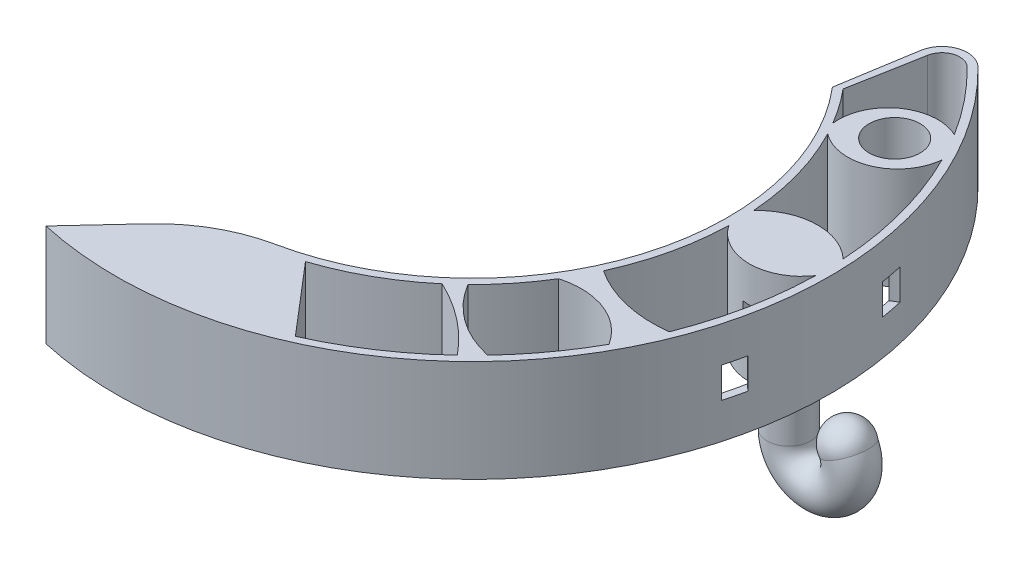
from build123d import *

# Parameters (mm, degrees)
BOSS_EXTRUDE1_DEPTH        = 13.33
FILLET1_R                  = 20
SKETCH3_R                  = 3.33
CUT_EXTRUDE2_DEPTH         = 68.320131462
FILLET2_R                  = 3.333
SKETCH4_R                  = 2.8333333
DOME1_FACE_RADIUS          = 2.8333333
DOME1_HEIGHT               = 3.3333333
CUT_EXTRUDE3_DEPTH         = 2
MIRROR3_COPY_1_FACE_RADIUS = 2.8333333
MIRROR3_COPY_1_HEIGHT      = 3.3333333
SKETCH16_W                 = 36.728720905
SKETCH16_H                 = 19.011400322
CUT_EXTRUDE4_DEPTH         = 30
CUT_EXTRUDE5_DEPTH         = 71.999747127
SKETCH19_R                 = 1.425
CUT_EXTRUDE6_DEPTH         = 8.6


with BuildPart() as part:
    # Sketch1 → Boss-Extrude1 (new body)
    with BuildSketch(Plane(origin=(0, 0, 0), x_dir=(1, 0, 0), z_dir=(0, 1, 0))):
        with BuildLine():
            Line((25.438564969, 21.535280641), (27.993333135, 37.33))
            ThreePointArc((27.993333135, 37.33), (42.371570445, -19.53984693), (-10.216878485, -45.527694802))
            Line((-10.216878485, -45.527694802), (1.110949751, -33.311479863))
            ThreePointArc((1.110949751, -33.311479863), (30.46737546, -13.513990254), (25.438564969, 21.535280641))
        make_face()
    extrude(amount=BOSS_EXTRUDE1_DEPTH)

    # Fillet1
    fillet1_edges = [part.edges().sort_by_distance(p)[0] for p in [
        (1.110949751, 6.665, 33.311479863),
    ]]
    fillet(fillet1_edges, radius=FILLET1_R)

    # Sketch3 → Cut-Extrude2 (cut, through all)
    with BuildSketch(Plane(origin=(0, 13.33, 0), x_dir=(1, 0, 0), z_dir=(0, 1, 0))):
        with Locations(Location((35.289122258, 19.812921474, 0), (0, 0, 270))):
            Circle(SKETCH3_R)
    extrude(amount=-CUT_EXTRUDE2_DEPTH, mode=Mode.SUBTRACT)

    # Fillet2
    fillet2_edges = [part.edges().sort_by_distance(p)[0] for p in [
        (27.993333135, 6.665, -37.33),
    ]]
    fillet(fillet2_edges, radius=FILLET2_R)

    # Sweep1: sweep along a path in Sketch6
    with BuildLine(Plane.XY) as sweep1_path:
        Line((40.567020893, 13.33), (40.567020893, 20.636666))
        ThreePointArc((40.567020893, 20.636666), (45.529478945, 24.636666), (48.384610469, 18.938050913))
    # Sketch4 → Sweep1 (sweep)
    with BuildSketch(Plane(origin=(0, 13.33, 0), x_dir=(1, 0, 0), z_dir=(0, 1, 0))):
        with Locations((40.567020893, 0.715488074)):
            Circle(SKETCH4_R)
    sweep1 = sweep(path=sweep1_path.line)

    # Dome1: a dome of height H over a round flat face of radius A is a cap of a sphere of radius (A * A + H * H) / (2 * H)
    dome1_r = (DOME1_FACE_RADIUS * DOME1_FACE_RADIUS + DOME1_HEIGHT * DOME1_HEIGHT) / (2 * DOME1_HEIGHT)
    dome1_base = Plane((48.384610469, 18.938050913, -0.715488074), z_dir=(-0.414971112372, -0.909834587107, 0))
    with Locations(dome1_base.offset(DOME1_HEIGHT - dome1_r)):
        dome1_ball = Sphere(dome1_r, mode=Mode.PRIVATE)
    add(split(dome1_ball, bisect_by=dome1_base, keep=Keep.TOP, mode=Mode.PRIVATE))

    # Sketch7 → Cut-Extrude3 (cut, symmetric)
    with BuildSketch(Plane(origin=(0, 6.665, 0), x_dir=(1, 0, 0), z_dir=(0, 1, 0))):
        with BuildLine():
            ThreePointArc((44.965852541, -12.459041105), (45.327303444, -11.072089345), (45.645985213, -9.674690379))
            ThreePointArc((45.645985213, -9.674690379), (41.52914689, -0.997602982), (46.057874066, 7.47180276))
            ThreePointArc((46.057874066, 7.47180276), (45.806657105, 8.882891694), (45.51221871, 10.285599066))
            ThreePointArc((45.51221871, 10.285599066), (38.862616133, -0.933548234), (44.965852541, -12.459041105))
        make_face()
    extrude(amount=CUT_EXTRUDE3_DEPTH, both=True, mode=Mode.SUBTRACT)

    # Mirror3: Sweep1 across plane
    add(sweep1.mirror(Plane.ZX.offset(6.665)))

    # Mirror3 copy 1: a dome of height H over a round flat face of radius A is a cap of a sphere of radius (A * A + H * H) / (2 * H)
    mirror3_copy_1_r = (MIRROR3_COPY_1_FACE_RADIUS * MIRROR3_COPY_1_FACE_RADIUS + MIRROR3_COPY_1_HEIGHT * MIRROR3_COPY_1_HEIGHT) / (2 * MIRROR3_COPY_1_HEIGHT)
    mirror3_copy_1_base = Plane((48.384610469, -5.608050913, -0.715488074), z_dir=(-0.414971112372, 0.909834587107, 0))
    with Locations(mirror3_copy_1_base.offset(MIRROR3_COPY_1_HEIGHT - mirror3_copy_1_r)):
        mirror3_copy_1_ball = Sphere(mirror3_copy_1_r, mode=Mode.PRIVATE)
    add(split(mirror3_copy_1_ball, bisect_by=mirror3_copy_1_base, keep=Keep.TOP, mode=Mode.PRIVATE))

    # Sketch16 → Cut-Extrude4 (cut)
    with BuildSketch(Plane(origin=(0, 13.33, 0), x_dir=(1, 0, 0), z_dir=(0, 1, 0))):
        with Locations((41.954103887, 0)):
            Rectangle(SKETCH16_W, SKETCH16_H)
    extrude(amount=CUT_EXTRUDE4_DEPTH, mode=Mode.SUBTRACT)

    # Sketch18 → Cut-Extrude5 (cut, through all)
    with BuildSketch(Plane.XZ):
        with BuildLine():
            Line((28.039143401, -31.35294351), (26.341104847, -22.015791956))
            ThreePointArc((26.341104847, -22.015791956), (28.034108775, -19.815086303), (29.543730196, -17.484762112))
            ThreePointArc((29.543730196, -17.484762112), (32.195597251, -23.521489799), (38.760601016, -24.1340301))
            ThreePointArc((38.760601016, -24.1340301), (35.637384762, -28.544919116), (32.014856699, -32.555868143))
            ThreePointArc((32.014856699, -32.555868143), (29.659442281, -33.169198731), (28.039143401, -31.35294351))
        make_face()
        with BuildLine():
            Line((18.550254331, 41.721980589), (10.749078367, 32.603776074))
            ThreePointArc((10.749078367, 32.603776074), (16.777611199, 29.950970977), (22.188585816, 26.195716434))
            ThreePointArc((22.188585816, 26.195716434), (27.124492616, 29.226219474), (31.260994101, 33.280412374))
            ThreePointArc((31.260994101, 33.280412374), (25.260742984, 38.035910189), (18.550254331, 41.721980589))
        make_face()
        with BuildLine():
            ThreePointArc((40.820629514, -20.457561098), (36.928571374, -15.146521153), (30.394540812, -15.959974588))
            ThreePointArc((30.394540812, -15.959974588), (33.016991898, -9.403570916), (34.242514373, -2.449307946))
            ThreePointArc((34.242514373, -2.449307946), (39.834796056, -4.973265496), (45.573843855, -2.803632696))
            ThreePointArc((45.573843855, -2.803632696), (44.089869065, -11.870932812), (40.820629514, -20.457561098))
        make_face()
        with BuildLine():
            ThreePointArc((45.651589838, 0.876324867), (39.98520163, 3.873028579), (34.318813422, 0.876324867))
            ThreePointArc((34.318813422, 0.876324867), (33.458600037, 7.685764997), (31.260994101, 14.187993085))
            ThreePointArc((31.260994101, 14.187993085), (36.627069292, 16.498940097), (42.462553984, 16.785919968))
            ThreePointArc((42.462553984, 16.785919968), (44.769458221, 8.973918351), (45.651589838, 0.876324867))
        make_face()
        with BuildLine():
            ThreePointArc((39.931059829, 22.143758962), (35.264351947, 18.298272838), (29.224062449, 18.013968857))
            ThreePointArc((29.224062449, 18.013968857), (26.794540492, 21.461628545), (23.960583625, 24.58534792))
            ThreePointArc((23.960583625, 24.58534792), (27.897400776, 28.917406773), (33.24466644, 31.299005627))
            ThreePointArc((33.24466644, 31.299005627), (36.873111669, 26.929709168), (39.931059829, 22.143758962))
        make_face()
    extrude(amount=-CUT_EXTRUDE5_DEPTH, mode=Mode.SUBTRACT)

    # Sketch19 → Cut-Extrude6 (cut, symmetric)
    with BuildSketch(Plane(origin=(15.613362891, 0, 27.64706404), x_dir=(0.8707413871359999, 0, -0.491741229437267), z_dir=(0.491741229437267, 0, 0.8707413871359999))):
        with Locations(Location((-14.136648815, 6.665, 0), (0, 0, 180))):
            Circle(SKETCH19_R)
    extrude(amount=CUT_EXTRUDE6_DEPTH, both=True, mode=Mode.SUBTRACT)


solid = part.part
